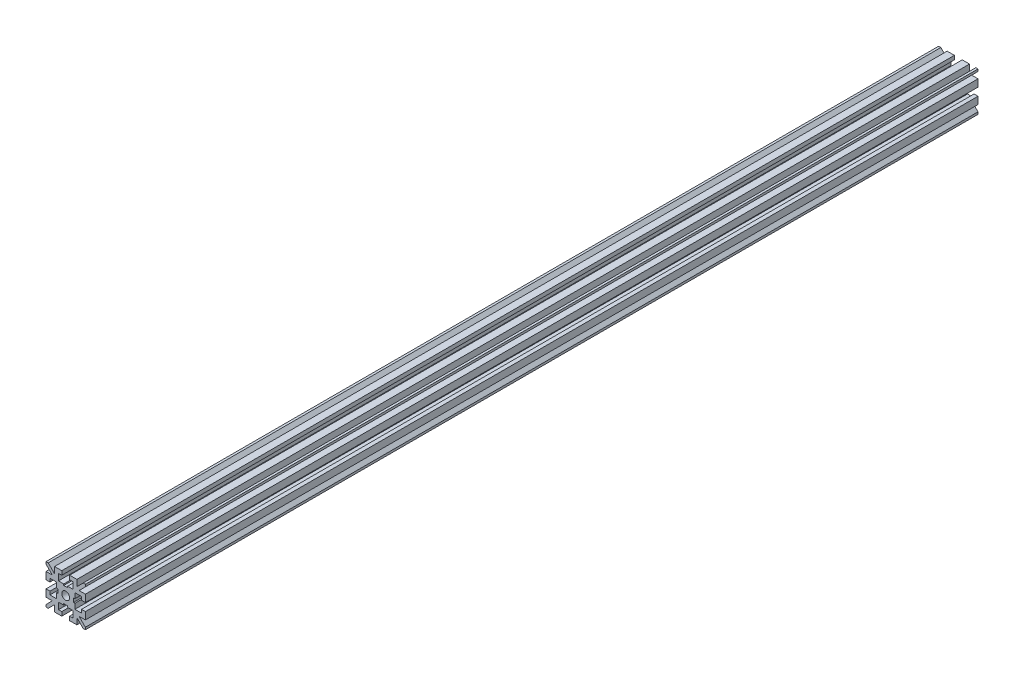
from build123d import *

# Parameters (mm, degrees)
SKETCH1_W           = 15
SKETCH1_H           = 15
BOSS_EXTRUDE1_DEPTH = 340
SKETCH2_R           = 1.5
CUT_EXTRUDE1_DEPTH  = 340
SKETCH3_W           = 3
SKETCH3_H           = 1.5
SKETCH3_W_2         = 1.5
SKETCH3_H_2         = 3
CUT_EXTRUDE2_DEPTH  = 340


with BuildPart() as part:
    # Sketch1 → Boss-Extrude1 (new body)
    with BuildSketch(Plane.XY):
        with Locations((-1.500578266, -3.738353388)):
            Rectangle(SKETCH1_W, SKETCH1_H)
    extrude(amount=BOSS_EXTRUDE1_DEPTH)

    # Sketch2 → Cut-Extrude1 (cut)
    with BuildSketch(Plane.XY.offset(340)):
        with Locations((-1.500578266, -3.738353388)):
            Circle(SKETCH2_R)
        Polygon((1.999421734, -4.488353388), (1.999421734, -6.488353388), (4.499421734, -6.488353388), (4.499421734, -0.988353388), (1.999421734, -0.988353388), (1.999421734, -2.988353388), (1.499421734, -2.988353388), (1.499421734, -4.488353388), align=None)
        Polygon((-4.250578266, -7.238353388), (-4.250578266, -9.738353388), (1.249421734, -9.738353388), (1.249421734, -7.238353388), (-0.750578266, -7.238353388), (-0.750578266, -6.738353388), (-2.250578266, -6.738353388), (-2.250578266, -7.238353388), align=None)
        Polygon((-5.000578266, -0.988353388), (-7.500578266, -0.988353388), (-7.500578266, -6.488353388), (-5.000578266, -6.488353388), (-5.000578266, -4.488353388), (-4.500578266, -4.488353388), (-4.500578266, -2.988353388), (-5.000578266, -2.988353388), align=None)
        Polygon((1.249421734, -0.238353388), (1.249421734, 2.261646612), (-4.250578266, 2.261646612), (-4.250578266, -0.238353388), (-2.250578266, -0.238353388), (-2.250578266, -0.738353388), (-0.750578266, -0.738353388), (-0.750578266, -0.238353388), align=None)
    extrude(amount=-CUT_EXTRUDE1_DEPTH, mode=Mode.SUBTRACT)

    # Sketch3 → Cut-Extrude2 (cut)
    with BuildSketch(Plane.XY.offset(340)):
        Polygon((5.150893596, 3.761646612), (2.749421734, 1.360174749), (2.749421734, 3.761646612), align=None)
        Polygon((5.999421734, 0.511646612), (5.999421734, 2.913118474), (3.597949871, 0.511646612), align=None)
        with Locations((-1.500578266, 3.011646612)):
            Rectangle(SKETCH3_W, SKETCH3_H)
        Polygon((2.749421734, -8.836881526), (2.749421734, -11.238353388), (5.150893596, -11.238353388), align=None)
        Polygon((5.999421734, -10.389825251), (3.597949871, -7.988353388), (5.999421734, -7.988353388), align=None)
        with Locations((5.249421734, -3.738353388)):
            Rectangle(SKETCH3_W_2, SKETCH3_H_2)
        Polygon((-6.599106404, -7.988353388), (-9.000578266, -7.988353388), (-9.000578266, -10.389825251), align=None)
        Polygon((-8.152050129, -11.238353388), (-5.750578266, -8.836881526), (-5.750578266, -11.238353388), align=None)
        with Locations((-1.500578266, -10.488353388)):
            Rectangle(SKETCH3_W, SKETCH3_H)
        Polygon((-5.750578266, 1.360174749), (-5.750578266, 3.761646612), (-8.152050129, 3.761646612), align=None)
        Polygon((-9.000578266, 2.913118474), (-6.599106404, 0.511646612), (-9.000578266, 0.511646612), align=None)
        with Locations((-8.250578266, -3.738353388)):
            Rectangle(SKETCH3_W_2, SKETCH3_H_2)
    extrude(amount=-CUT_EXTRUDE2_DEPTH, mode=Mode.SUBTRACT)


solid = part.part
